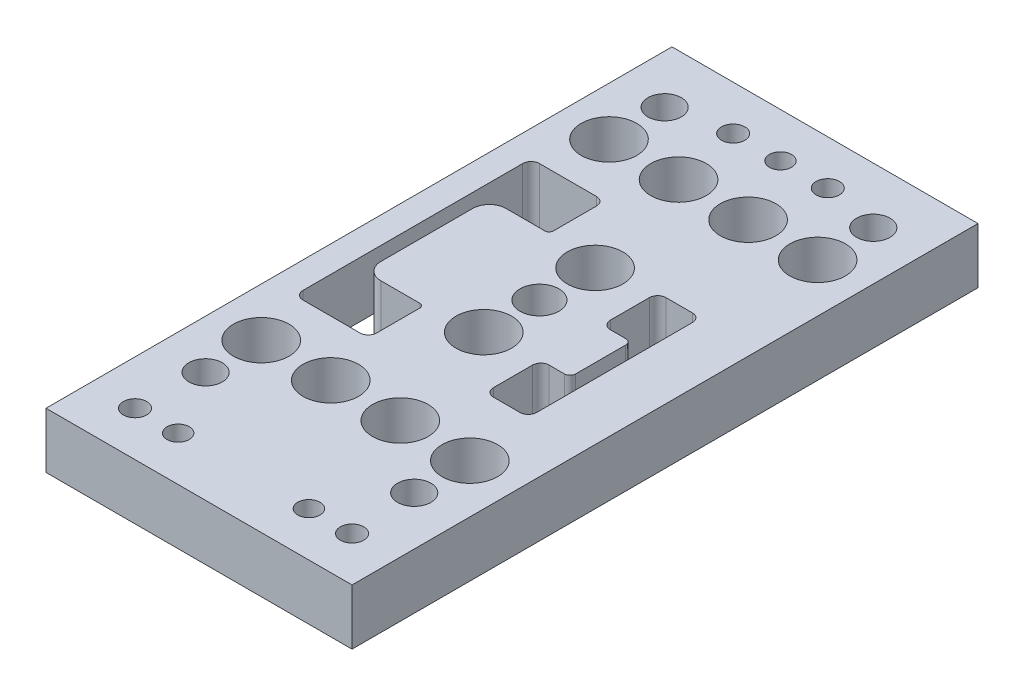
from build123d import *

# Parameters (mm, degrees)
SKETCH1_W                                           = 110
SKETCH1_H                                           = 225
BOSS_EXTRUDE1_DEPTH                                 = 20
CUT_EXTRUDE1_REACH                                  = 128.812
CUT_EXTRUDE2_REACH                                  = 128.812
SKETCH4_R                                           = 10
CUT_EXTRUDE3_DEPTH                                  = 127.81186853
CUT_EXTRUDE4_REACH                                  = 128.812
SKETCH5_R                                           = 6
CUT_EXTRUDE5_REACH                                  = 128.812
SKETCH6_R                                           = 7
CBORE_FOR_M8_HEX_SOCKET_HEAD_CAP_SCREW1_D           = 8.4
CBORE_FOR_M8_HEX_SOCKET_HEAD_CAP_SCREW1_CBORE_D     = 15
CBORE_FOR_M8_HEX_SOCKET_HEAD_CAP_SCREW1_CBORE_DEPTH = 8.6
F_8_0MM_DOWEL_HOLE1_D                               = 8


with BuildPart() as part:
    # Sketch1 → Boss-Extrude1 (new body)
    with BuildSketch(Plane(origin=(0, 0, 0), x_dir=(1, 0, 0), z_dir=(0, 1, 0))):
        Rectangle(SKETCH1_W, SKETCH1_H)
    extrude(amount=BOSS_EXTRUDE1_DEPTH)

    # Sketch2 → Cut-Extrude1 (cut, up to next)
    with BuildSketch(Plane(origin=(0, 20, 0), x_dir=(1, 0, 0), z_dir=(0, 1, 0)), mode=Mode.PRIVATE) as cut_extrude1_sk1:
        with BuildLine():
            Line((-42.5, -32.64), (-22, -32.64))
            ThreePointArc((-22, -32.64), (-19.878679656, -31.761320344), (-19, -29.64))
            Line((-19, -29.64), (-19, -14.14))
            ThreePointArc((-19, -14.14), (-19.439339828, -13.079339828), (-20.5, -12.64))
            Line((-20.5, -12.64), (-34.5, -12.64))
            ThreePointArc((-34.5, -12.64), (-38.742640687, -10.882640687), (-40.5, -6.64))
            Line((-40.5, -6.64), (-40.5, 26.36))
            ThreePointArc((-40.5, 26.36), (-38.742640687, 30.602640687), (-34.5, 32.36))
            Line((-34.5, 32.36), (-20.5, 32.36))
            ThreePointArc((-20.5, 32.36), (-19.439339828, 32.799339828), (-19, 33.86))
            Line((-19, 33.86), (-19, 49.36))
            ThreePointArc((-19, 49.36), (-19.878679656, 51.481320344), (-22, 52.36))
            Line((-22, 52.36), (-42.5, 52.36))
            ThreePointArc((-42.5, 52.36), (-44.621320344, 51.481320344), (-45.5, 49.36))
            Line((-45.5, 49.36), (-45.5, -29.64))
            ThreePointArc((-45.5, -29.64), (-44.621320344, -31.761320344), (-42.5, -32.64))
        make_face()
    cut_extrude1_tool1 = extrude(cut_extrude1_sk1.sketch, amount=-CUT_EXTRUDE1_REACH, mode=Mode.PRIVATE) & part.part
    add(cut_extrude1_tool1.solids().sort_by_distance((-43.991747, 20, -50.851747))[0], mode=Mode.SUBTRACT)

    # Sketch3 → Cut-Extrude2 (cut, up to next)
    with BuildSketch(Plane(origin=(0, 20, 0), x_dir=(1, 0, 0), z_dir=(0, 1, 0)), mode=Mode.PRIVATE) as cut_extrude2_sk1:
        with BuildLine():
            Line((22, -8.64), (27.5, -8.64))
            ThreePointArc((27.5, -8.64), (28.914213562, -8.054213562), (29.5, -6.64))
            Line((29.5, -6.64), (29.5, 11.36))
            ThreePointArc((29.5, 11.36), (28.914213562, 12.774213562), (27.5, 13.36))
            Line((27.5, 13.36), (22, 13.36))
            ThreePointArc((22, 13.36), (19.878679656, 14.238679656), (19, 16.36))
            Line((19, 16.36), (19, 30.36))
            ThreePointArc((19, 30.36), (19.878679656, 32.481320344), (22, 33.36))
            Line((22, 33.36), (31.5, 33.36))
            ThreePointArc((31.5, 33.36), (33.621320344, 32.481320344), (34.5, 30.36))
            Line((34.5, 30.36), (34.5, -25.64))
            ThreePointArc((34.5, -25.64), (33.621320344, -27.761320344), (31.5, -28.64))
            Line((31.5, -28.64), (22, -28.64))
            ThreePointArc((22, -28.64), (19.878679656, -27.761320344), (19, -25.64))
            Line((19, -25.64), (19, -11.64))
            ThreePointArc((19, -11.64), (19.878679656, -9.518679656), (22, -8.64))
        make_face()
    cut_extrude2_tool1 = extrude(cut_extrude2_sk1.sketch, amount=-CUT_EXTRUDE2_REACH, mode=Mode.PRIVATE) & part.part
    add(cut_extrude2_tool1.solids().sort_by_distance((24.75, 20, 9.279081))[0], mode=Mode.SUBTRACT)

    # Sketch4 → Cut-Extrude3 (cut, through all)
    with BuildSketch(Plane.XZ):
        with Locations(Location((37.5, 52.64, 0), (0, 0, 270))):
            Circle(SKETCH4_R)
        with Locations(Location((12.5, 52.64, 0), (0, 0, 270))):
            Circle(SKETCH4_R)
        with Locations(Location((-12.5, 52.64, 0), (0, 0, 270))):
            Circle(SKETCH4_R)
        with Locations(Location((-37.5, 52.64, 0), (0, 0, 270))):
            Circle(SKETCH4_R)
        with Locations(Location((0, 10.14, 0), (0, 0, 270))):
            Circle(SKETCH4_R)
        with Locations(Location((0, -29.86, 0), (0, 0, 270))):
            Circle(SKETCH4_R)
        with Locations(Location((37.5, -72.36, 0), (0, 0, 270))):
            Circle(SKETCH4_R)
        with Locations(Location((12.5, -72.36, 0), (0, 0, 270))):
            Circle(SKETCH4_R)
        with Locations(Location((-12.5, -72.36, 0), (0, 0, 270))):
            Circle(SKETCH4_R)
        with Locations(Location((-37.5, -72.36, 0), (0, 0, 270))):
            Circle(SKETCH4_R)
    extrude(amount=-CUT_EXTRUDE3_DEPTH, mode=Mode.SUBTRACT)

    # Sketch5 → Cut-Extrude4 (cut, up to next)
    with BuildSketch(Plane(origin=(0, 20, 0), x_dir=(1, 0, 0), z_dir=(0, 1, 0)), mode=Mode.PRIVATE) as cut_extrude4_sk1:
        with Locations(Location((-37.5, 92.36, 0), (0, 0, 270))):
            Circle(SKETCH5_R)
    cut_extrude4_tool1 = extrude(cut_extrude4_sk1.sketch, amount=-CUT_EXTRUDE4_REACH, mode=Mode.PRIVATE) & part.part
    # Sketch5 → Cut-Extrude4 (cut, up to next)
    with BuildSketch(Plane(origin=(0, 20, 0), x_dir=(1, 0, 0), z_dir=(0, 1, 0)), mode=Mode.PRIVATE) as cut_extrude4_sk2:
        with Locations(Location((37.5, 92.36, 0), (0, 0, 270))):
            Circle(SKETCH5_R)
    cut_extrude4_tool2 = extrude(cut_extrude4_sk2.sketch, amount=-CUT_EXTRUDE4_REACH, mode=Mode.PRIVATE) & part.part
    # Sketch5 → Cut-Extrude4 (cut, up to next)
    with BuildSketch(Plane(origin=(0, 20, 0), x_dir=(1, 0, 0), z_dir=(0, 1, 0)), mode=Mode.PRIVATE) as cut_extrude4_sk3:
        with Locations(Location((-37.5, -72.64, 0), (0, 0, 270))):
            Circle(SKETCH5_R)
    cut_extrude4_tool3 = extrude(cut_extrude4_sk3.sketch, amount=-CUT_EXTRUDE4_REACH, mode=Mode.PRIVATE) & part.part
    # Sketch5 → Cut-Extrude4 (cut, up to next)
    with BuildSketch(Plane(origin=(0, 20, 0), x_dir=(1, 0, 0), z_dir=(0, 1, 0)), mode=Mode.PRIVATE) as cut_extrude4_sk4:
        with Locations(Location((37.5, -72.64, 0), (0, 0, 270))):
            Circle(SKETCH5_R)
    cut_extrude4_tool4 = extrude(cut_extrude4_sk4.sketch, amount=-CUT_EXTRUDE4_REACH, mode=Mode.PRIVATE) & part.part
    add(cut_extrude4_tool1.solids().sort_by_distance((-37.5, 20, -92.36))[0], mode=Mode.SUBTRACT)
    add(cut_extrude4_tool2.solids().sort_by_distance((37.5, 20, -92.36))[0], mode=Mode.SUBTRACT)
    add(cut_extrude4_tool3.solids().sort_by_distance((-37.5, 20, 72.64))[0], mode=Mode.SUBTRACT)
    add(cut_extrude4_tool4.solids().sort_by_distance((37.5, 20, 72.64))[0], mode=Mode.SUBTRACT)

    # Sketch6 → Cut-Extrude5 (cut, up to next)
    with BuildSketch(Plane(origin=(0, 20, 0), x_dir=(1, 0, 0), z_dir=(0, 1, 0)), mode=Mode.PRIVATE) as cut_extrude5_sk1:
        with Locations(Location((0, 9.86, 0), (0, 0, 270))):
            Circle(SKETCH6_R)
    cut_extrude5_tool1 = extrude(cut_extrude5_sk1.sketch, amount=-CUT_EXTRUDE5_REACH, mode=Mode.PRIVATE) & part.part
    add(cut_extrude5_tool1.solids().sort_by_distance((0, 20, -9.86))[0], mode=Mode.SUBTRACT)

    # CBORE for M8 Hex Socket Head Cap Screw1 (through all)
    with Locations(Plane(origin=(0, 0, 0), x_dir=(-1, 0, 0), z_dir=(0, -1, 0))):
        with Locations((-17, 96.5), (17, 96.5), (-39, -96.5), (39, -96.5)):
            CounterBoreHole(CBORE_FOR_M8_HEX_SOCKET_HEAD_CAP_SCREW1_D / 2, CBORE_FOR_M8_HEX_SOCKET_HEAD_CAP_SCREW1_CBORE_D / 2, CBORE_FOR_M8_HEX_SOCKET_HEAD_CAP_SCREW1_CBORE_DEPTH)

    # Ø8.0mm Dowel Hole1 (through all)
    with Locations(Plane(origin=(0, 0, 0), x_dir=(-1, 0, 0), z_dir=(0, -1, 0))):
        with Locations((0, 96.5), (-23.5, -96.5), (23.5, -96.5)):
            Hole(F_8_0MM_DOWEL_HOLE1_D / 2)


solid = part.part
